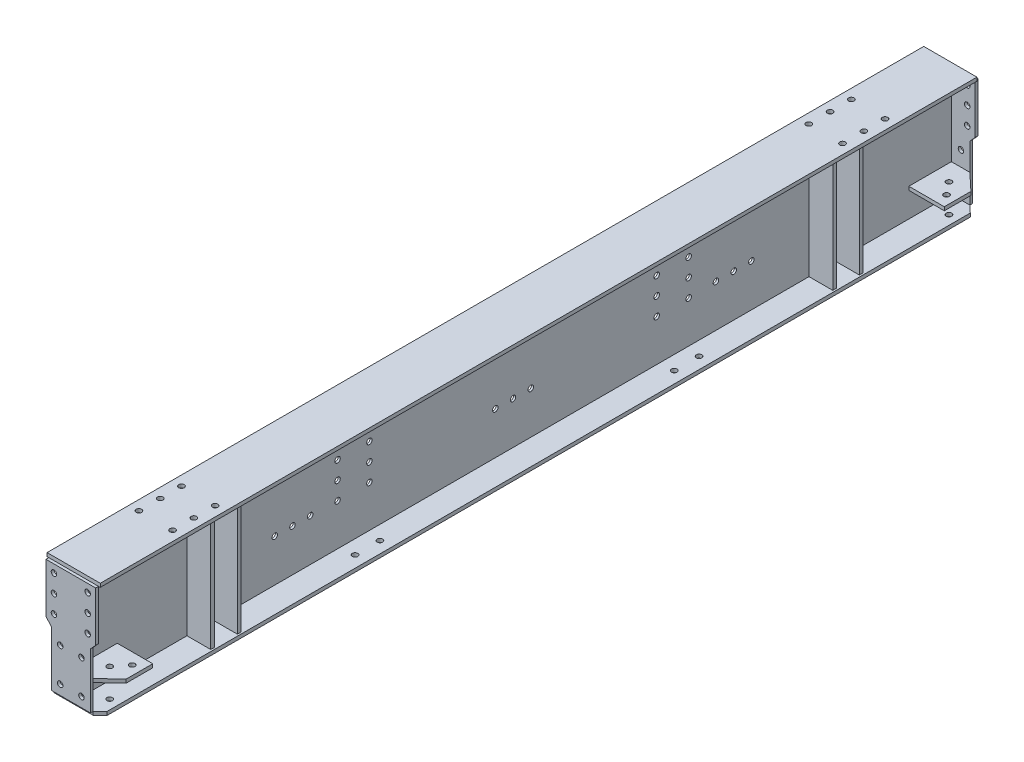
from build123d import *
from build123d.topology import SkipClean

# Parameters (mm, degrees)
EXTRUDE_1_DEPTH      = 2472
EXTRUDE_2_DEPTH      = 16
SKETCH_3_R           = 15.5
CUT_EXTRUDE_3_DEPTH  = 2515.59743299
SKETCH_4_R           = 15.5
CUT_EXTRUDE_5_DEPTH  = 20
EXTRUDE_6_DEPTH      = 10
EXTRUDE_6_2_DEPTH    = 10
SKETCH_7_R           = 15.5
CUT_EXTRUDE_7_DEPTH  = 10
SKETCH_8_W           = 280
SKETCH_8_H           = 20
EXTRUDE_8_DEPTH      = 625
EXTRUDE_8_2_DEPTH    = 625
SKETCH_9_R           = 15.5
CUT_EXTRUDE_9_DEPTH  = 625
SKETCH_10_R          = 15.5
CUT_EXTRUDE_10_DEPTH = 625
SKETCH_11_R          = 15.5
CUT_EXTRUDE_11_DEPTH = 2579.488898561


with BuildPart() as part:
    # 草图1 → 拉伸1 (new body)
    with BuildSketch(Plane.XY):
        Polygon((-150, 332.5), (150, 332.5), (150, 312.5), (6, 312.5), (6, -312.5), (150, -312.5), (150, -332.5), (-150, -332.5), (-150, -312.5), (-6, -312.5), (-6, 312.5), (-150, 312.5), align=None)
    extrude(amount=EXTRUDE_1_DEPTH)

    # 草图4 → 拉伸5 (cut)
    with BuildSketch(Plane(origin=(0, 332.5, 0), x_dir=(1, 0, 0), z_dir=(0, 1, 0))):
        with Locations(Location((-95, -2009, 0), (0, 0, 270))):
            Circle(SKETCH_4_R)
        with Locations(Location((-95, -1889, 0), (0, 0, 270))):
            Circle(SKETCH_4_R)
        with Locations(Location((-95, -1769, 0), (0, 0, 270))):
            Circle(SKETCH_4_R)
        with Locations(Location((95, -2009, 0), (0, 0, 90))):
            Circle(SKETCH_4_R)
        with Locations(Location((95, -1889, 0), (0, 0, 90))):
            Circle(SKETCH_4_R)
        with Locations(Location((95, -1769, 0), (0, 0, 90))):
            Circle(SKETCH_4_R)
    extrude(amount=-CUT_EXTRUDE_5_DEPTH, mode=Mode.SUBTRACT)

    # 草图9 → 拉伸9 (cut)
    with BuildSketch(Plane(origin=(6, 0, 0), x_dir=(0, 0, -1), z_dir=(1, 0, 0))):
        with Locations((-1344, -73.5)):
            Circle(SKETCH_9_R)
        with Locations((-1244, -73.5)):
            Circle(SKETCH_9_R)
        with Locations((-1144, -73.5)):
            Circle(SKETCH_9_R)
        with Locations((-990, -77.5)):
            Circle(SKETCH_9_R)
        with Locations((-990, 22.5)):
            Circle(SKETCH_9_R)
        with Locations((-990, 122.5)):
            Circle(SKETCH_9_R)
        with Locations((-810, 122.5)):
            Circle(SKETCH_9_R)
        with Locations((-810, 22.5)):
            Circle(SKETCH_9_R)
        with Locations((-810, -77.5)):
            Circle(SKETCH_9_R)
        with Locations((-100, -73.5)):
            Circle(SKETCH_9_R)
        with BuildLine():
            Line((0, -88.5), (0, -58.5))
            ThreePointArc((0, -58.5), (-15, -73.5), (0, -88.5))
        make_face()
    extrude(amount=-CUT_EXTRUDE_9_DEPTH, mode=Mode.SUBTRACT)

    # 草图10 → 拉伸10 (cut)
    with BuildSketch(Plane(origin=(0, -312.5, 0), x_dir=(1, 0, 0), z_dir=(0, 1, 0))):
        with Locations(Location((85, -970, 0), (0, 0, 180))):
            Circle(SKETCH_10_R)
        with Locations(Location((85, -830, 0), (0, 0, 270))):
            Circle(SKETCH_10_R)
        with Locations(Location((-85, -830, 0), (0, 0, 180))):
            Circle(SKETCH_10_R)
        with Locations(Location((-85, -970, 0), (0, 0, 270))):
            Circle(SKETCH_10_R)
    extrude(amount=-CUT_EXTRUDE_10_DEPTH, mode=Mode.SUBTRACT)

    # 草图11 → 拉伸11 (cut, through all)
    with BuildSketch(Plane(origin=(0, -312.5, 0), x_dir=(1, 0, 0), z_dir=(0, 1, 0))):
        with Locations(Location((-97.738221798, -2366.413652083, 0), (0, 0, 90))):
            Circle(SKETCH_11_R)
        with Locations(Location((97.738221798, -2366.413652083, 0), (0, 0, 270))):
            Circle(SKETCH_11_R)
        Polygon((110, -2472), (150, -2472), (150, -2434.5), align=None)
        Polygon((-150, -2434.5), (-110, -2472), (-150, -2472), align=None)
    extrude(amount=-CUT_EXTRUDE_11_DEPTH, mode=Mode.SUBTRACT)

    # 镜向3: part across plane


with BuildPart() as body_2:
    # 草图2 → 拉伸2 (new body)
    with BuildSketch(Plane.XY.offset(2472)):
        Polygon((-140, 32.5), (-140, 312.5), (140, 312.5), (140, 32.5), (110, -0.5), (110, -312.5), (-110, -312.5), (-110, -0.5), align=None)
    extrude(amount=EXTRUDE_2_DEPTH)

    # 草图3 → 拉伸3 (cut, through all)
    with BuildSketch(Plane.XY.offset(2488)):
        with Locations((-95, 267.5)):
            Circle(SKETCH_3_R)
        with Locations((-95, 167.5)):
            Circle(SKETCH_3_R)
        with Locations((-95, 67.5)):
            Circle(SKETCH_3_R)
        with Locations((-60, -67.5)):
            Circle(SKETCH_3_R)
        with Locations((-60, -257.5)):
            Circle(SKETCH_3_R)
        with Locations((60, -257.5)):
            Circle(SKETCH_3_R)
        with Locations((60, -67.5)):
            Circle(SKETCH_3_R)
        with Locations((95, 67.5)):
            Circle(SKETCH_3_R)
        with Locations((95, 167.5)):
            Circle(SKETCH_3_R)
        with Locations((95, 267.5)):
            Circle(SKETCH_3_R)
    extrude(amount=-CUT_EXTRUDE_3_DEPTH, mode=Mode.SUBTRACT)


with BuildPart() as body_3:
    # 草图6 → 拉伸6 (new, symmetric)
    with BuildSketch(Plane.XZ.offset(162.5)):
        Polygon((-110, 2472), (-6, 2472), (-6, 2232), (-206, 2232), (-206, 2382), align=None)
    extrude(amount=EXTRUDE_6_DEPTH, both=True)


with BuildPart() as body_4:
    # 草图6 → Extrude 6 2 (new, symmetric)
    with BuildSketch(Plane.XZ.offset(162.5)):
        Polygon((6, 2232), (6, 2472), (110, 2472), (206, 2382), (206, 2232), align=None)
    extrude(amount=EXTRUDE_6_2_DEPTH, both=True)


with BuildPart() as cut_extrude_7_tool:
    # 草图7 → 拉伸7 (new, symmetric)
    with BuildSketch(Plane.XZ.offset(162.5)):
        with Locations(Location((-97.738221798, 2366.413652083, 0), (0, 0, 270))):
            Circle(SKETCH_7_R)
        with Locations(Location((-154.125657451, 2296.267682131, 0), (0, 0, 270))):
            Circle(SKETCH_7_R)
        with Locations(Location((154.125657451, 2296.267682131, 0), (0, 0, 90))):
            Circle(SKETCH_7_R)
        with Locations(Location((97.738221798, 2366.413652083, 0), (0, 0, 90))):
            Circle(SKETCH_7_R)
    extrude(amount=CUT_EXTRUDE_7_DEPTH, both=True)


with BuildPart() as body_3_1:
    add(body_3.part)

    # 拉伸7: cut by cut_extrude_7_tool
    add(cut_extrude_7_tool.part, mode=Mode.SUBTRACT)


with BuildPart() as body_4_1:
    add(body_4.part)

    # 拉伸7: cut by cut_extrude_7_tool
    add(cut_extrude_7_tool.part, mode=Mode.SUBTRACT)


with BuildPart() as body_5:
    # 草图8 → 拉伸8 (new body)
    with BuildSketch(Plane.XZ.offset(-312.5)):
        with Locations((0, 1829)):
            Rectangle(SKETCH_8_W, SKETCH_8_H)
    extrude(amount=EXTRUDE_8_DEPTH)


with BuildPart() as body_6:
    # 草图8 → Extrude 8 2 (new body)
    with BuildSketch(Plane.XZ.offset(-312.5)):
        with Locations((0, 1679)):
            Rectangle(SKETCH_8_W, SKETCH_8_H)
    extrude(amount=EXTRUDE_8_2_DEPTH)


with BuildPart() as part_1:
    with SkipClean():  # the faces are left unmerged after this step: merging them gives an invalid solid
        add(part.part)
        add(part.part.mirror(Plane.XY))


with BuildPart() as body_7:
    # 镜向8: mirrored copy
    add(body_2.part.mirror(Plane.XY))


with BuildPart() as body_8:
    # Mirror 8 2: mirrored copy
    add(body_4_1.part.mirror(Plane.XY))


with BuildPart() as body_9:
    # Mirror 8 3: mirrored copy
    add(body_5.part.mirror(Plane.XY))


with BuildPart() as body_10:
    # Mirror 8 4: mirrored copy
    add(body_6.part.mirror(Plane.XY))


with BuildPart() as body_11:
    # Mirror 8 5: mirrored copy
    add(body_3_1.part.mirror(Plane.XY))


solid = Compound([body_2.part, body_3_1.part, body_4_1.part, body_5.part, body_6.part, part_1.part, body_7.part, body_8.part, body_9.part, body_10.part, body_11.part])
